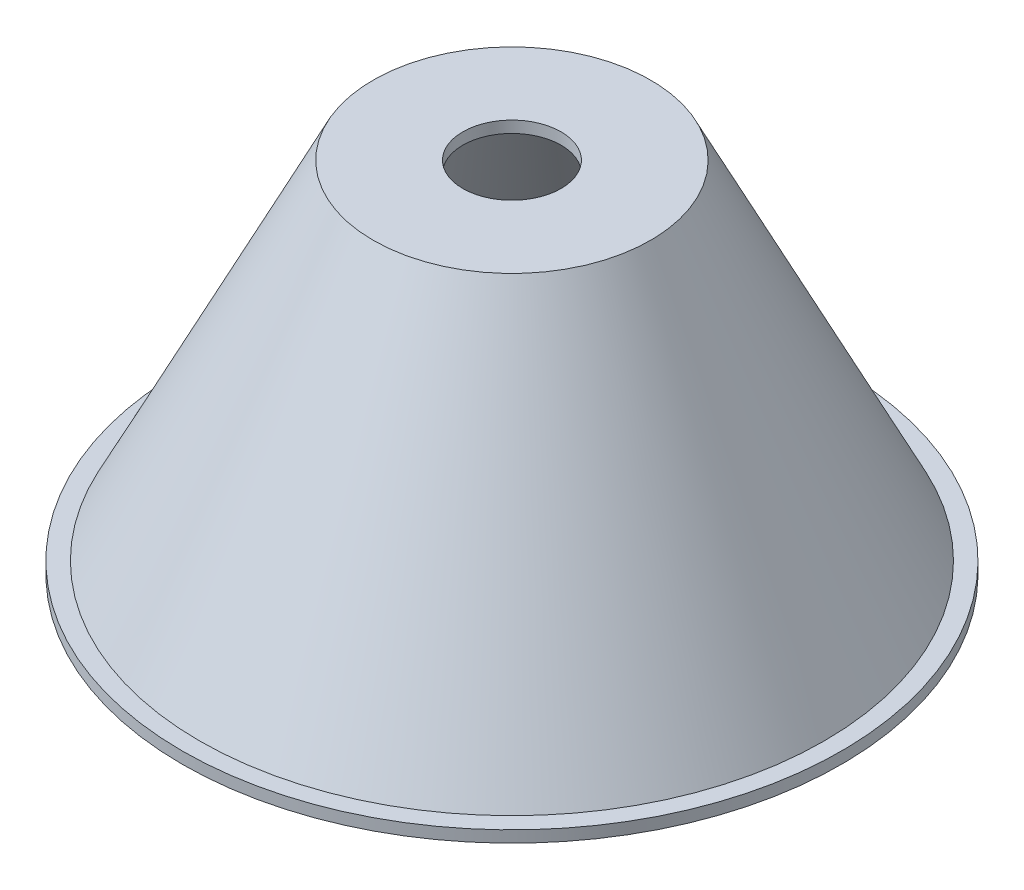
from build123d import *

# Parameters (mm, degrees)
SKETCH1_R           = 28.5
BOSS_EXTRUDE1_DEPTH = 1
SKETCH8_R           = 27
SKETCH3_R           = 12
SKETCH9_R           = 25.75
CUT_EXTRUDE1_DEPTH  = 30
CUT_EXTRUDE1_DRAFT  = -25
SKETCH10_R          = 4.25
CUT_EXTRUDE2_DEPTH  = 5


with BuildPart() as part:
    # Sketch1 → Boss-Extrude1 (new body)
    with BuildSketch(Plane(origin=(0, 0, 0), x_dir=(1, 0, 0), z_dir=(0, 1, 0))):
        with Locations(Location((0, 0, 0), (0, 0, 270))):
            Circle(SKETCH1_R)
    extrude(amount=BOSS_EXTRUDE1_DEPTH)

    # Sketch8 → Loft2 section 0
    with BuildSketch(Plane(origin=(0, 1, 0), x_dir=(1, 0, 0), z_dir=(0, 1, 0))):
        Circle(SKETCH8_R)
    # Sketch3 → Loft2 section 1
    with BuildSketch(Plane(origin=(0, 31, 0), x_dir=(1, 0, 0), z_dir=(0, 1, 0))):
        Circle(SKETCH3_R)
    loft()


with BuildPart() as cut_extrude1_tool:
    # Sketch9 → Cut-Extrude1 (with draft: the straight prism first)
    with BuildSketch(Plane.XZ):
        Circle(SKETCH9_R)
    extrude(amount=-CUT_EXTRUDE1_DEPTH)
    # Cut-Extrude1: the draft: its side faces are tilted about the plane it starts from
    cut_extrude1_sides = [cut_extrude1_tool.faces().sort_by_distance(p)[0] for p in [
        (-25.75, 15, 0),
    ]]
    draft(cut_extrude1_sides, Plane.XZ, CUT_EXTRUDE1_DRAFT)


with BuildPart() as part_1:
    add(part.part)

    # Cut-Extrude1: cut by cut_extrude1_tool
    add(cut_extrude1_tool.part, mode=Mode.SUBTRACT)

    # Sketch10 → Cut-Extrude2 (cut)
    with BuildSketch(Plane.XZ.offset(-30)):
        with Locations(Location((0, 0, 0), (0, 0, 270))):
            Circle(SKETCH10_R)
    extrude(amount=-CUT_EXTRUDE2_DEPTH, mode=Mode.SUBTRACT)


solid = part_1.part
